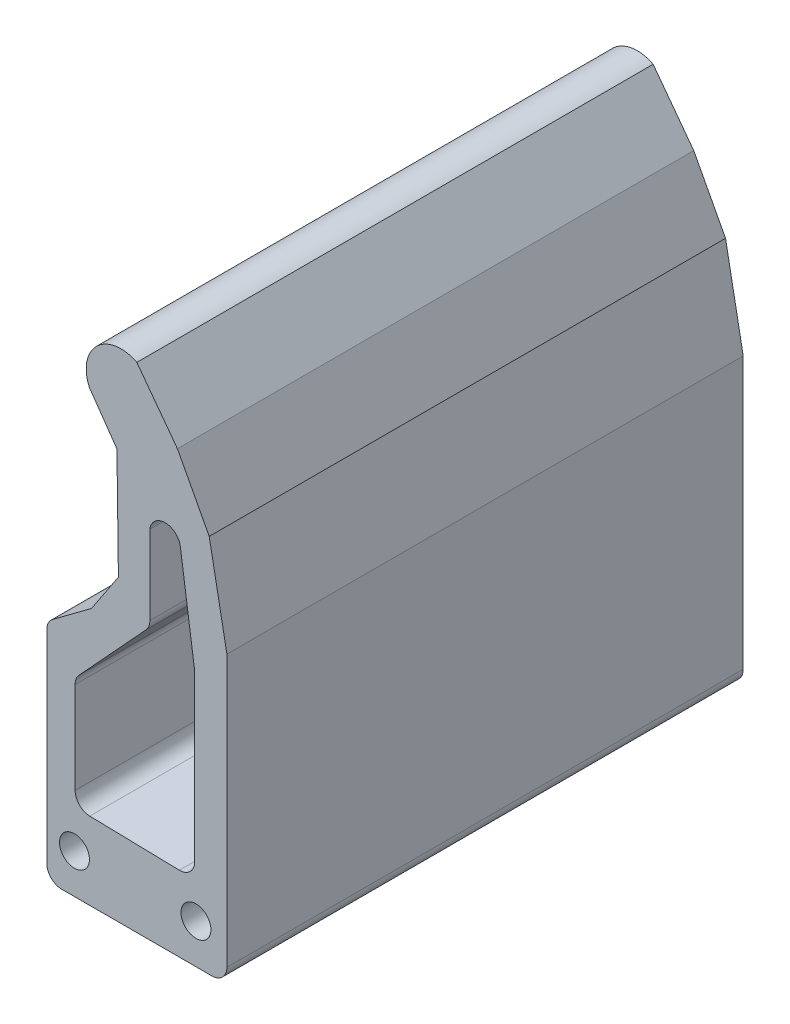
from build123d import *

# Parameters (mm, degrees)
BOSS_EXTRUDE1_DEPTH = 34.5
FILLET1_R           = 1
SKETCH2_R           = 1
CUT_EXTRUDE1_DEPTH  = 496.614236654


with BuildPart() as part:
    # Sketch1 → Boss-Extrude1 (new body)
    with BuildSketch(Plane.XY.offset(40)):
        with BuildLine():
            Line((-312.030492528, 377.868524993), (-310.193868717, 375.244776692))
            Line((-310.193868717, 375.244776692), (-310.096008301, 367.875213623))
            Line((-310.096008301, 367.875213623), (-311.889068604, 365.166412354))
            Line((-311.889068604, 365.166412354), (-314.88168335, 362.936676025))
            Line((-314.88168335, 362.936676025), (-314.88168335, 347.918438133))
            Line((-314.88168335, 347.918438133), (-302.847373473, 347.918438133))
            Line((-302.847373473, 347.918438133), (-302.847373473, 367.04556325))
            Line((-302.847373473, 367.04556325), (-304.028060208, 373.263846724))
            Line((-304.028060208, 373.263846724), (-306.153296332, 377.278181625))
            Line((-306.153296332, 377.278181625), (-308.864528411, 380.917030307))
            ThreePointArc((-308.864528411, 380.917030307), (-311.535911341, 380.523114569), (-312.030492528, 377.868524993))
        make_face()
        with BuildLine():
            Line((-312.988408734, 360.598376943), (-312.988408734, 353.109979303))
            Line((-312.988408734, 353.109979303), (-305, 352.927314193))
            Line((-305, 352.927314193), (-305, 365))
            Line((-305, 365), (-305.952850342, 371.670013428))
            ThreePointArc((-305.952850342, 371.670013428), (-306.959348498, 372.584855641), (-307.99460106, 371.702683918))
            Line((-307.99460106, 371.702683918), (-307.99460106, 366.023339102))
            Line((-307.99460106, 366.023339102), (-312.988408734, 360.598376943))
        make_face(mode=Mode.SUBTRACT)
    extrude(amount=BOSS_EXTRUDE1_DEPTH)

    # Fillet1
    fillet1_edges = [part.edges().sort_by_distance(p)[0] for p in [
        (-302.847373473, 347.918438133, 57.25),
        (-314.88168335, 347.918438133, 57.25),
        (-314.88168335, 362.936676025, 57.25),
        (-307.99460106, 366.023339102, 57.25),
        (-312.988408734, 360.598376943, 57.25),
        (-312.988408734, 353.109979303, 57.25),
        (-305, 352.927314193, 57.25),
    ]]
    fillet(fillet1_edges, radius=FILLET1_R)

    # Sketch2 → Cut-Extrude1 (cut, through all)
    with BuildSketch(Plane.XY.offset(74.5)):
        with Locations((-313.031111026, 350.560286037)):
            Circle(SKETCH2_R)
        with Locations((-304.91451991, 350.560286037)):
            Circle(SKETCH2_R)
    extrude(amount=-CUT_EXTRUDE1_DEPTH, mode=Mode.SUBTRACT)


solid = part.part
